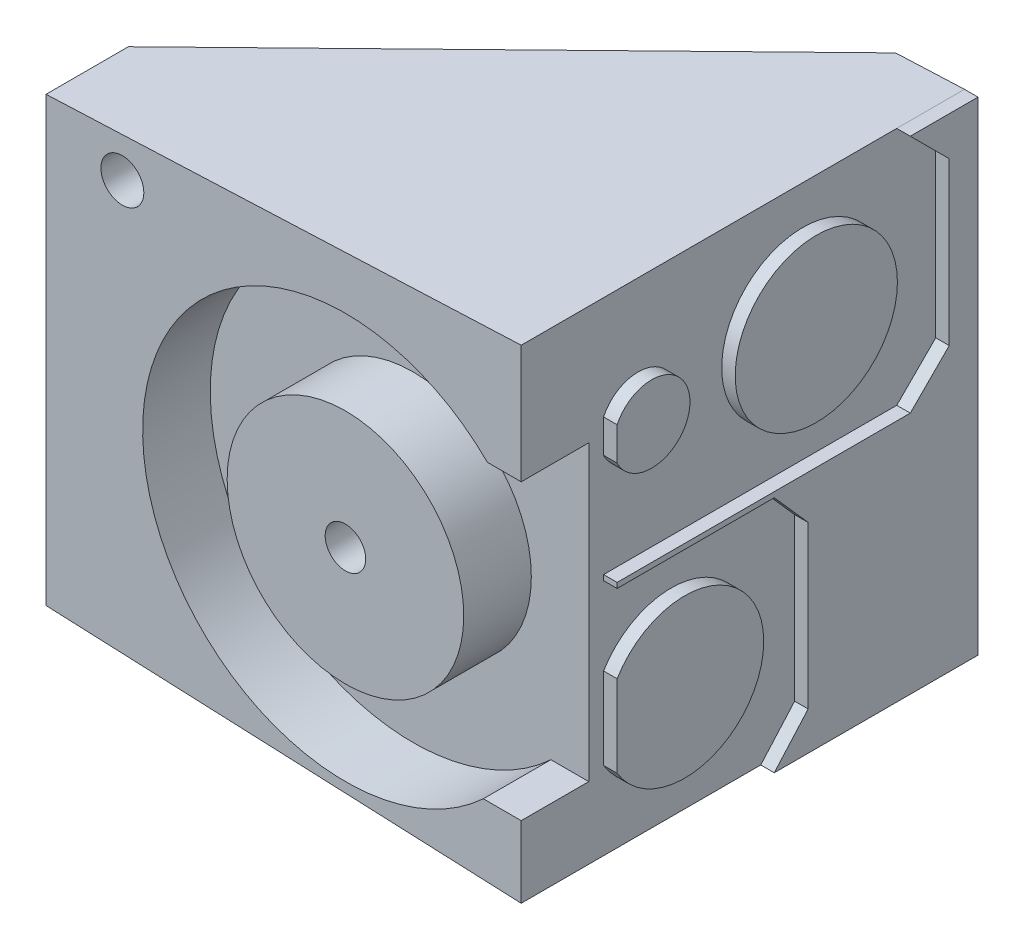
from build123d import *

# Parameters (mm, degrees)
CROQUIS1_W                 = 72.3
CROQUIS1_H                 = 65.58
SALIENTE_EXTRUIR1_DEPTH    = 35.75
CROQUIS2_R                 = 12
CORTAR_EXTRUIR1_DEPTH      = 2
CROQUIS3_R                 = 17.5
CROQUIS3_R_2               = 3
CORTAR_EXTRUIR2_DEPTH      = 10
CORTAR_EXTRUIR3_DEPTH      = 61.49850494
CORTAR_EXTRUIR3_DEPTH_BACK = 61.49850494
CORTAR_EXTRUIR4_DEPTH      = 31
CROQUIS3_3_R               = 3.175
CORTAR_EXTRUIR5_DEPTH      = 83.979644492
CORTAR_EXTRUIR6_DEPTH      = 83.979644492


with BuildPart() as part:
    # Croquis1 → Saliente-Extruir1 (new, symmetric)
    with BuildSketch(Plane(origin=(0, 0, 0), x_dir=(1, 0, 0), z_dir=(0, 1, 0))):
        Rectangle(CROQUIS1_W, CROQUIS1_H)
    extrude(amount=SALIENTE_EXTRUIR1_DEPTH, both=True)

    # Croquis2 → Cortar-Extruir1 (cut)
    with BuildSketch(Plane(origin=(36.15, 0, 0), x_dir=(0, 0, -1), z_dir=(1, 0, 0))):
        Polygon((-20.6, -0.51), (-20.6, 0.27), (22.77, 0.27), (28.535, 6.035), (28.535, 29.985), (22.77, 35.75), (-32.79, 35.75), (-32.79, -35.75), (2.65, -35.75), (7.66, -30.08), (7.66, -6.18), (2.65, -0.51), align=None)
        with BuildLine():
            Line((-20.6, 15.553009972), (-20.6, 20.466990028))
            ThreePointArc((-20.6, 20.466990028), (-9.82, 18.01), (-20.6, 15.553009972))
        make_face(mode=Mode.SUBTRACT)
        with BuildLine():
            Line((-20.6, -24.184428132), (-20.6, -12.075571868))
            ThreePointArc((-20.6, -12.075571868), (1.09, -18.13), (-20.6, -24.184428132))
        make_face(mode=Mode.SUBTRACT)
        with Locations((8.87, 18.01)):
            Circle(CROQUIS2_R, mode=Mode.SUBTRACT)
    extrude(amount=-CORTAR_EXTRUIR1_DEPTH, mode=Mode.SUBTRACT)

    # Croquis3 → Cortar-Extruir2 (cut)
    # profile 1 of 2: a face of its own
    with BuildSketch(Plane.XY.offset(32.79)):
        with BuildLine():
            Line((34.15, -25.16), (34.15, 18.25))
            Line((34.15, 18.25), (29.164563997, 18.25))
            ThreePointArc((29.164563997, 18.25), (-21.846955575, -2.732617016), (28.546078054, -25.16))
            Line((28.546078054, -25.16), (34.15, -25.16))
        make_face()
        with Locations((8.15, -3.16)):
            Circle(CROQUIS3_R, mode=Mode.SUBTRACT)
    # profile 2 of 2: a face of its own
    with BuildSketch(Plane.XY.offset(32.79)):
        with Locations((8.15, -3.16)):
            Circle(CROQUIS3_R_2)
    extrude(amount=-CORTAR_EXTRUIR2_DEPTH, mode=Mode.SUBTRACT)

    # Croquis4 → Cortar-Extruir3 (cut, two sides: drawn at the far end of the back side and taken through both)
    with BuildSketch(Plane(origin=(0, 0, 0), x_dir=(1, 0, 0), z_dir=(0, 1, 0)).offset(-CORTAR_EXTRUIR3_DEPTH_BACK)):
        Polygon((-36.15, 32.79), (23.958, 32.79), (-36.15, -20.6), align=None)
    extrude(amount=CORTAR_EXTRUIR3_DEPTH + CORTAR_EXTRUIR3_DEPTH_BACK, mode=Mode.SUBTRACT)

    # Croquis5 → Cortar-Extruir4 (cut, symmetric)
    with BuildSketch(Plane(origin=(0, 0, 0), x_dir=(1, 0, 0), z_dir=(0, 1, 0))):
        Polygon((23.958, 32.79), (23.958, -20.6), (-36.15, -20.6), align=None)
    extrude(amount=CORTAR_EXTRUIR4_DEPTH, both=True, mode=Mode.SUBTRACT)

    # Croquis3<3> → Cortar-Extruir5 (cut, through all)
    with BuildSketch(Plane.XY.offset(32.79)):
        with Locations((-24.852904541, 27.365641017)):
            Circle(CROQUIS3_3_R)
    extrude(amount=-CORTAR_EXTRUIR5_DEPTH, mode=Mode.SUBTRACT)

    # Croquis6 → Cortar-Extruir6 (cut, through all)
    with BuildSketch(Plane.XY.offset(32.79)):
        Polygon((-36.15, 32.75), (-36.15, 35.75), (34.15, 35.75), align=None)
        Polygon((-36.15, -32.75), (-36.15, -35.75), (34.15, -35.75), align=None)
    extrude(amount=-CORTAR_EXTRUIR6_DEPTH, mode=Mode.SUBTRACT)


solid = part.part
